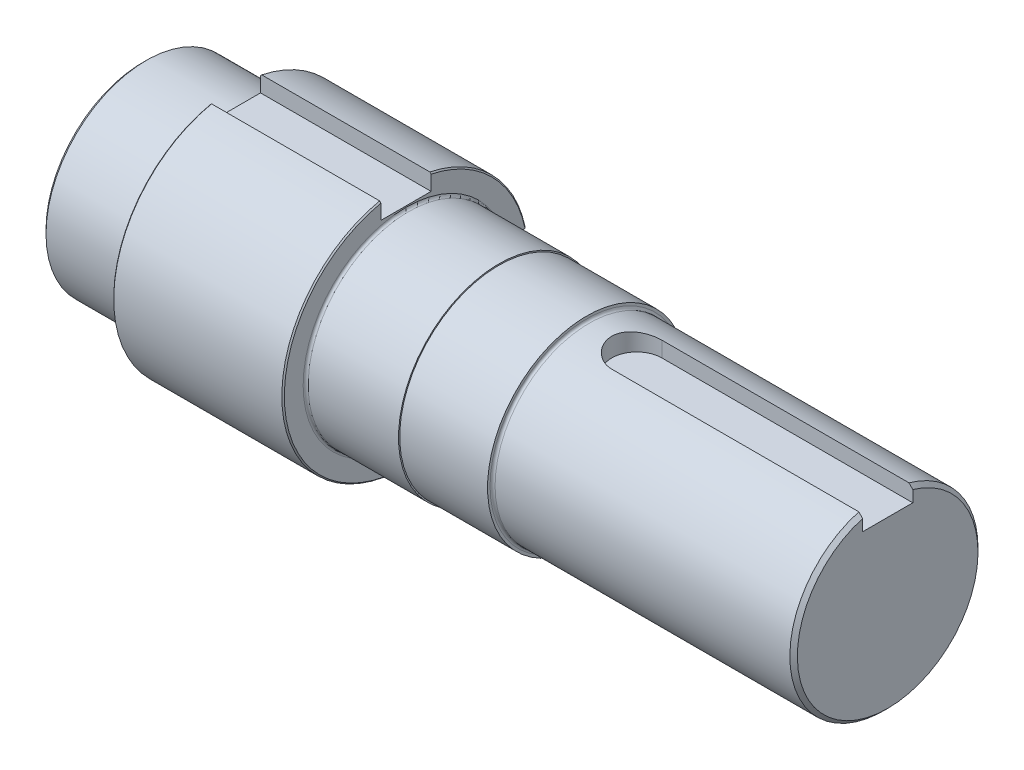
from build123d import *

# Parameters (mm, degrees)
EXTRUDE1_DEPTH = 68
FILLET1_R      = 1
EXTRUDE2_DEPTH = 7.5
CHAMFER1_SIZE  = 1.5
CHAMFER2_SIZE  = 0.5


with BuildPart() as part:
    # Sketch1 → Revolve1 (revolve)
    with BuildSketch(Plane.XY, mode=Mode.PRIVATE) as revolve1_sk:
        Polygon((0, 0), (297, 0), (297, 37.5), (177, 37.5), (177, 39.5), (142, 39.5), (142, 40), (105, 40), (105, 49), (37, 49), (37, 40), (0, 40), align=None)
    revolve(revolve1_sk.sketch.rotate(Axis((0, 0, 0), (-1, 0, 0)), 90), axis=Axis((0, 0, 0), (-1, 0, 0)))

    # Sketch2 → Extrude1 (cut)
    with BuildSketch(Plane.ZY.offset(-37)):
        with BuildLine():
            Line((-10, 47.968739821), (-10, 41.5))
            Line((-10, 41.5), (10, 41.5))
            Line((10, 41.5), (10, 47.968739821))
            ThreePointArc((10, 47.968739821), (0, 49), (-10, 47.968739821))
        make_face()
        with BuildLine():
            Line((-47.968739821, 10), (-41.5, 10))
            Line((-41.5, 10), (-41.5, -10))
            Line((-41.5, -10), (-47.968739821, -10))
            ThreePointArc((-47.968739821, -10), (-49, 0), (-47.968739821, 10))
        make_face()
    extrude(amount=-EXTRUDE1_DEPTH, mode=Mode.SUBTRACT)

    # Fillet1
    fillet1_edges = [part.edges().sort_by_distance(p)[0] for p in [
        (177, 0, 37.5),
        (105, 0, 40),
        (37, 0, 40),
    ]]
    fillet(fillet1_edges, radius=FILLET1_R)

    # Sketch3 → Extrude2 (cut)
    with BuildSketch(Plane(origin=(237.5, 37.5, 0), x_dir=(0, 0, 1), z_dir=(0, 1, 0))):
        with BuildLine():
            Line((-10, 59.5), (-10, -40.5))
            ThreePointArc((-10, -40.5), (0, -50.5), (10, -40.5))
            Line((10, -40.5), (10, 59.5))
            ThreePointArc((10, 59.5), (0, 69.5), (-10, 59.5))
        make_face()
    extrude(amount=-EXTRUDE2_DEPTH, mode=Mode.SUBTRACT)

    # Chamfer1
    chamfer1_edges = [part.edges().sort_by_distance(p)[0] for p in [
        (0, 0, 40),
        (297, -29.843340966, 22.707377656),
    ]]
    chamfer(chamfer1_edges, length=CHAMFER1_SIZE)

    # Chamfer2
    chamfer2_edges = [part.edges().sort_by_distance(p)[0] for p in [
        (105, -34.648232278, 34.648232278),
        (37, -34.648232278, 34.648232278),
        (105, 34.648232278, -34.648232278),
        (37, 34.648232278, -34.648232278),
    ]]
    chamfer(chamfer2_edges, length=CHAMFER2_SIZE)


solid = part.part
